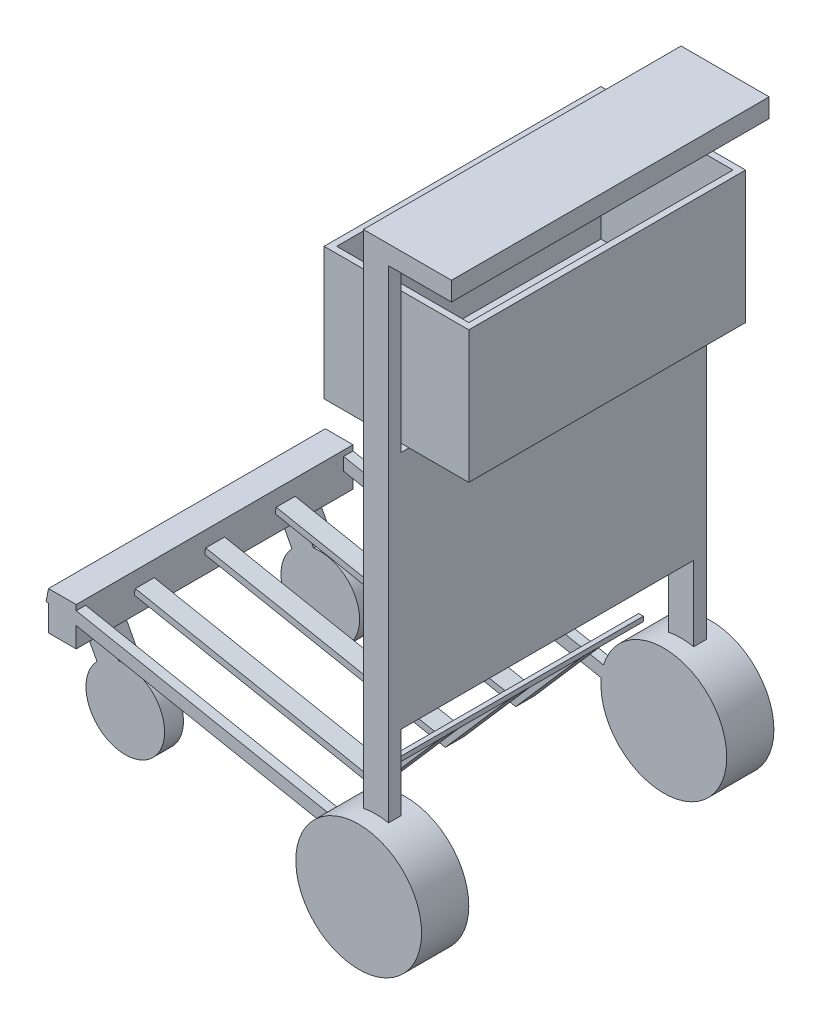
from build123d import *

# Parameters (mm, degrees)
BOSS_EXTRUDE1_DEPTH  = 40
SKETCH3_W            = 505
SKETCH3_H            = 30
BOSS_EXTRUDE2_DEPTH  = 100
BOSS_EXTRUDE3_START  = 205
SKETCH5_R            = 100
BOSS_EXTRUDE3_DEPTH  = 75
BOSS_EXTRUDE4_START  = -205
SKETCH5_2_R          = 100
BOSS_EXTRUDE4_DEPTH  = 75
SKETCH7_W            = 505
SKETCH7_H            = 381
BOSS_EXTRUDE5_DEPTH  = 30
SKETCH8_W            = 230
SKETCH8_H            = 440
SKETCH8_W_2          = 210
SKETCH8_H_2          = 420
EXTRUDE_THIN1_DEPTH  = 210
SKETCH9_W            = 230
SKETCH9_H            = 440
BOSS_EXTRUDE6_DEPTH  = 10
SKETCH10_W           = 505
SKETCH10_H           = 7.5
BOSS_EXTRUDE7_DEPTH  = 7.5
BOSS_EXTRUDE8_START  = 205
BOSS_EXTRUDE8_DEPTH  = 15
BOSS_EXTRUDE9_START  = -205
BOSS_EXTRUDE9_DEPTH  = 15
BOSS_EXTRUDE10_REACH = 1238.243
SKETCH12_W           = 44.047720934
SKETCH12_H           = 61.152550191
BOSS_EXTRUDE11_START = 140
SKETCH13_R           = 62.5
BOSS_EXTRUDE11_DEPTH = 30
BOSS_EXTRUDE12_START = -140
SKETCH13_4_R         = 62.5
BOSS_EXTRUDE12_DEPTH = 30
EXTRUDE_THIN5_DEPTH  = 15
LPATTERN1_COUNT      = 2
LPATTERN1_PITCH      = 112
SKETCH15_W           = 7.5
SKETCH15_H           = 7.5
CUT_EXTRUDE1_DEPTH   = 60
MIRROR1_COPY_1_DEPTH = 15
MIRROR1_COPY_2_DEPTH = 15


with BuildPart() as part:
    # Sketch1 → Boss-Extrude1 (new body)
    with BuildSketch(Plane(origin=(0, 0, 0), x_dir=(0, 0, -1), z_dir=(1, 0, 0))):
        Polygon((-232.5, 0), (-252.5, 0), (-252.5, 995), (252.5, 995), (252.5, 0), (232.5, 0), (232.5, 965), (-232.5, 965), align=None)
    extrude(amount=BOSS_EXTRUDE1_DEPTH)

    # Sketch3 → Boss-Extrude2 (add)
    with BuildSketch(Plane(origin=(40, 0, 0), x_dir=(0, 0, -1), z_dir=(1, 0, 0))):
        with Locations((0, 980)):
            Rectangle(SKETCH3_W, SKETCH3_H)
    extrude(amount=BOSS_EXTRUDE2_DEPTH)

    # Sketch5<2> → Boss-Extrude4 (add)
    with BuildSketch(Plane.XY.offset(BOSS_EXTRUDE4_START)):
        with Locations((20, 100)):
            Circle(SKETCH5_2_R)
    extrude(amount=-BOSS_EXTRUDE4_DEPTH)

    # Sketch7 → Boss-Extrude5 (add)
    with BuildSketch(Plane(origin=(40, 0, 0), x_dir=(0, 0, -1), z_dir=(1, 0, 0))):
        with Locations((0, 507.5)):
            Rectangle(SKETCH7_W, SKETCH7_H)
    extrude(amount=-BOSS_EXTRUDE5_DEPTH)

    # Sketch8 → Extrude-Thin1 (add)
    with BuildSketch(Plane(origin=(0, 698, 0), x_dir=(1, 0, 0), z_dir=(0, 1, 0))):
        with Locations((20, 0)):
            Rectangle(SKETCH8_W, SKETCH8_H)
        with Locations((20, 0)):
            Rectangle(SKETCH8_W_2, SKETCH8_H_2, mode=Mode.SUBTRACT)
    extrude(amount=EXTRUDE_THIN1_DEPTH)

    # Sketch9 → Boss-Extrude6 (add)
    with BuildSketch(Plane.XZ.offset(-698)):
        with Locations((20, 0)):
            Rectangle(SKETCH9_W, SKETCH9_H)
    extrude(amount=-BOSS_EXTRUDE6_DEPTH)

    # Sketch10 → Boss-Extrude7 (add)
    with BuildSketch(Plane.ZY):
        with Locations((0, 236.25)):
            Rectangle(SKETCH10_W, SKETCH10_H)
    extrude(amount=BOSS_EXTRUDE7_DEPTH)


with BuildPart() as body_2:
    # Sketch5 → Boss-Extrude3 (new body)
    with BuildSketch(Plane.XY.offset(BOSS_EXTRUDE3_START)):
        with Locations((20, 100)):
            Circle(SKETCH5_R)
    extrude(amount=BOSS_EXTRUDE3_DEPTH)


    add(part.part)  # Boss-Extrude8 merges part
    # Sketch11 → Boss-Extrude8 (add)
    with BuildSketch(Plane.XY.offset(BOSS_EXTRUDE8_START)):
        Polygon((21.910116732, 109.815877652), (-533.089883268, 217.815877652), (-536.910116732, 198.184122348), (18.089883268, 90.184122348), align=None)
    extrude(amount=BOSS_EXTRUDE8_DEPTH)

    # Sketch11<2> → Boss-Extrude9 (add)
    with BuildSketch(Plane.XY.offset(BOSS_EXTRUDE9_START)):
        Polygon((21.910116732, 109.815877652), (-533.089883268, 217.815877652), (-536.910116732, 198.184122348), (18.089883268, 90.184122348), align=None)
    extrude(amount=-BOSS_EXTRUDE9_DEPTH)

    # Boss-Extrude10: up to this face of the body (flat: up to its plane)
    boss_extrude10_end = Plane(body_2.part.faces().sort_by_distance((-306.497442612, 163.534637481, -220))[0])
    # Sketch12 → Boss-Extrude10 (add, up to the picked face)
    with BuildSketch(Plane.XY.offset(220), mode=Mode.PRIVATE) as boss_extrude10_sk1:
        with Locations((-511.066022801, 187.239602557)):
            Rectangle(SKETCH12_W, SKETCH12_H)
    boss_extrude10_tool1 = split(extrude(boss_extrude10_sk1.sketch, amount=-BOSS_EXTRUDE10_REACH, mode=Mode.PRIVATE), bisect_by=boss_extrude10_end, keep=Keep.BOTH, mode=Mode.PRIVATE)
    add(boss_extrude10_tool1.solids().sort_by(Axis((-511.066023, 187.239603, 220), (0, 0, -1)))[0])

    # Sketch13 → Boss-Extrude11 (add)
    with BuildSketch(Plane.XY.offset(BOSS_EXTRUDE11_START)):
        with Locations((-461.066022801, 62.5)):
            Circle(SKETCH13_R)
        with BuildLine():
            Line((-493.886091971, 165.785738113), (-443.886091971, 71.622410652))
            ThreePointArc((-443.886091971, 71.622410652), (-451.943612148, 45.32006917), (-478.245953631, 53.377589348))
            Line((-478.245953631, 53.377589348), (-528.245953631, 147.540916809))
            ThreePointArc((-528.245953631, 147.540916809), (-520.188433453, 173.843258291), (-493.886091971, 165.785738113))
        make_face()
    extrude(amount=BOSS_EXTRUDE11_DEPTH)

    # Sketch13<4> → Boss-Extrude12 (add)
    with BuildSketch(Plane.XY.offset(BOSS_EXTRUDE12_START)):
        with Locations((-461.066022801, 62.5)):
            Circle(SKETCH13_4_R)
        with BuildLine():
            Line((-493.886091971, 165.785738113), (-443.886091971, 71.622410652))
            ThreePointArc((-443.886091971, 71.622410652), (-451.943612148, 45.32006917), (-478.245953631, 53.377589348))
            Line((-478.245953631, 53.377589348), (-528.245953631, 147.540916809))
            ThreePointArc((-528.245953631, 147.540916809), (-520.188433453, 173.843258291), (-493.886091971, 165.785738113))
        make_face()
    extrude(amount=-BOSS_EXTRUDE12_DEPTH)

    # Sketch14 → Extrude-Thin5 (add, symmetric)
    with BuildSketch(Plane.XY):
        Polygon((-7.52287052, 239.53107422), (-111.10842632, 120.419203046), (-488.087103968, 193.777215994), (-489.9972207, 183.961338343), (-107.351343448, 109.500518985), (0.02287052, 232.96892578), align=None)
    extrude_thin5 = extrude(amount=EXTRUDE_THIN5_DEPTH, both=True)

    # LPattern1: Extrude-Thin5 ×2
    with Locations(*[(0, 0, -i * LPATTERN1_PITCH) for i in range(1, LPATTERN1_COUNT)]):
        add(extrude_thin5)

    # Sketch15 → Cut-Extrude1 (cut)
    with BuildSketch(Plane(origin=(0, 0, -252.5), x_dir=(-1, 0, 0), z_dir=(0, 0, -1))):
        with Locations((3.75, 236.25)):
            Rectangle(SKETCH15_W, SKETCH15_H)
    cut_extrude1 = extrude(amount=-CUT_EXTRUDE1_DEPTH, mode=Mode.SUBTRACT)

    # Mirror1: Cut-Extrude1 across plane
    add(cut_extrude1.mirror(Plane.XY), mode=Mode.SUBTRACT)

    # Mirror1 copy 1 sketch → Mirror1 copy 1 (add, symmetric)
    with BuildSketch(Plane(origin=(0, 0, 112), x_dir=(1, 0, 0), z_dir=(0, 0, -1))):
        Polygon((-7.52287052, -239.53107422), (-111.10842632, -120.419203046), (-488.087103968, -193.777215994), (-489.9972207, -183.961338343), (-107.351343448, -109.500518985), (0.02287052, -232.96892578), align=None)
    extrude(amount=MIRROR1_COPY_1_DEPTH, both=True)

    # Mirror1 copy 2 sketch → Mirror1 copy 2 (add, symmetric)
    with BuildSketch(Plane(origin=(0, 0, 0), x_dir=(1, 0, 0), z_dir=(0, 0, -1))):
        Polygon((-7.52287052, -239.53107422), (-111.10842632, -120.419203046), (-488.087103968, -193.777215994), (-489.9972207, -183.961338343), (-107.351343448, -109.500518985), (0.02287052, -232.96892578), align=None)
    extrude(amount=MIRROR1_COPY_2_DEPTH, both=True)


solid = body_2.part
